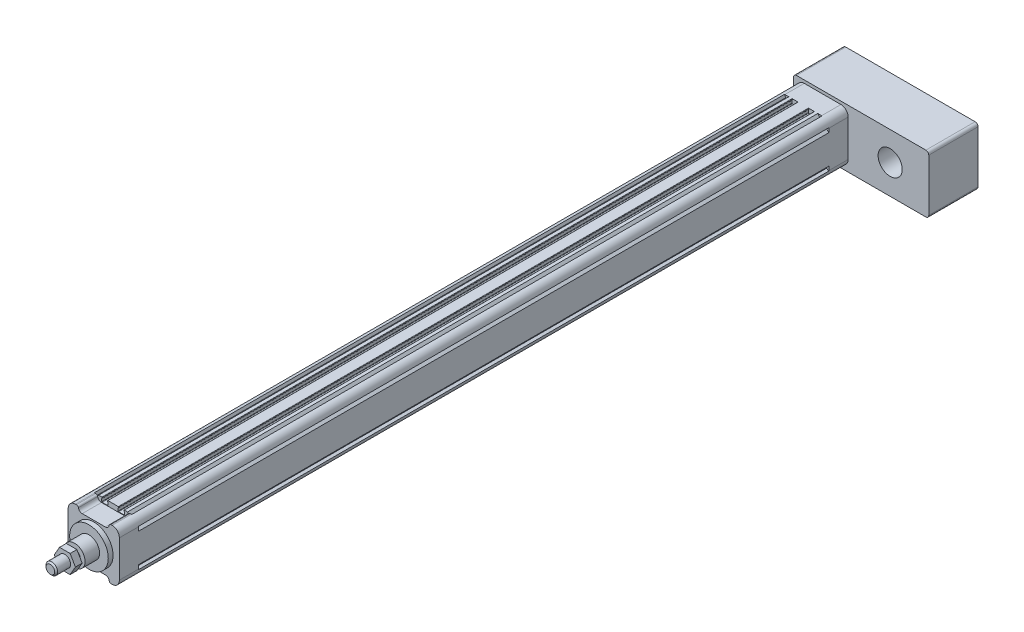
from build123d import *

# Parameters (mm, degrees)
SKETCH_1_R                  = 2.1
EXTRUDE_1_DEPTH             = 715
EXTRUDE_2_DEPTH             = 20
SKETCH_7_R                  = 20
EXTRUDE_3_DEPTH             = 5
SKETCH_9_R                  = 11
EXTRUDE_4_DEPTH             = 15
SKETCH_10_R                 = 6
EXTRUDE_5_DEPTH             = 25
EXTRUDE_START               = 20
EXTRUDE_6_DEPTH             = 20
EXTRUDE_7_DEPTH             = 51
SKETCH_13_R                 = 12.5
CUT_EXTRUDE_2_DEPTH         = 30
PATTERN_LINEAR_1_COUNT      = 2
PATTERN_LINEAR_1_PITCH      = 38
PATTERN_LINEAR_1_COUNT_DIR2 = 2
PATTERN_LINEAR_1_PITCH_DIR2 = 38
HOLE_WIZARD_M6_2_D          = 5
HOLE_WIZARD_M6_2_DEPTH      = 15
HOLE_WIZARD_M6_2_TIP        = 1.502151548
HOLE_WIZARD_M6_3_D          = 5
HOLE_WIZARD_M6_3_DEPTH      = 15
HOLE_WIZARD_M6_3_TIP        = 1.502151548
HOLE_WIZARD_M6_4_D          = 5
HOLE_WIZARD_M6_4_DEPTH      = 15
HOLE_WIZARD_M6_4_TIP        = 1.502151548
CHAMFER_1_SIZE              = 1.5
EXTRUDE_START_2             = 3
EXTRUDE_8_DEPTH             = 7


with BuildPart() as part:
    # 草图1 → 凸台-拉伸1 (new body)
    with BuildSketch(Plane.XY):
        with BuildLine():
            Line((-18.2, 24), (-19.443439638, 26.486879276))
            ThreePointArc((-19.443439638, 26.486879276), (-24.303300859, 24.303300859), (-26.486879276, 19.443439638))
            Line((-26.486879276, 19.443439638), (-24, 18.2))
            Line((-24, 18.2), (-24, 17.1))
            Line((-24, 17.1), (-26.5, 15))
            Line((-26.5, 15), (-26.5, -15))
            Line((-26.5, -15), (-24, -17.1))
            Line((-24, -17.1), (-24, -18.2))
            Line((-24, -18.2), (-26.486879276, -19.443439638))
            ThreePointArc((-26.486879276, -19.443439638), (-24.303300859, -24.303300859), (-19.443439638, -26.486879276))
            Line((-19.443439638, -26.486879276), (-18.2, -24))
            Line((-18.2, -24), (-17.1, -24))
            Line((-17.1, -24), (-15, -26.5))
            Line((-15, -26.5), (-11.65, -26.5))
            ThreePointArc((-11.65, -26.5), (-11.367157288, -26.382842712), (-11.25, -26.1))
            Line((-11.25, -26.1), (-11.25, -25.6))
            ThreePointArc((-11.25, -25.6), (-11.367157288, -25.317157288), (-11.65, -25.2))
            Line((-11.65, -25.2), (-11.75, -25.2))
            Line((-11.75, -25.2), (-11.75, -22.4))
            ThreePointArc((-11.75, -22.4), (-11.632842712, -22.117157288), (-11.35, -22))
            Line((-11.35, -22), (-5.65, -22))
            ThreePointArc((-5.65, -22), (-5.367157288, -22.117157288), (-5.25, -22.4))
            Line((-5.25, -22.4), (-5.25, -25.2))
            Line((-5.25, -25.2), (-5.35, -25.2))
            ThreePointArc((-5.35, -25.2), (-5.632842712, -25.317157288), (-5.75, -25.6))
            Line((-5.75, -25.6), (-5.75, -26.1))
            ThreePointArc((-5.75, -26.1), (-5.632842712, -26.382842712), (-5.35, -26.5))
            Line((-5.35, -26.5), (5.35, -26.5))
            ThreePointArc((5.35, -26.5), (5.632842712, -26.382842712), (5.75, -26.1))
            Line((5.75, -26.1), (5.75, -25.6))
            ThreePointArc((5.75, -25.6), (5.632842712, -25.317157288), (5.35, -25.2))
            Line((5.35, -25.2), (5.25, -25.2))
            Line((5.25, -25.2), (5.25, -22.4))
            ThreePointArc((5.25, -22.4), (5.367157288, -22.117157288), (5.65, -22))
            Line((5.65, -22), (11.35, -22))
            ThreePointArc((11.35, -22), (11.632842712, -22.117157288), (11.75, -22.4))
            Line((11.75, -22.4), (11.75, -25.2))
            Line((11.75, -25.2), (11.65, -25.2))
            ThreePointArc((11.65, -25.2), (11.367157288, -25.317157288), (11.25, -25.6))
            Line((11.25, -25.6), (11.25, -26.1))
            ThreePointArc((11.25, -26.1), (11.367157288, -26.382842712), (11.65, -26.5))
            Line((11.65, -26.5), (15, -26.5))
            Line((15, -26.5), (17.1, -24))
            Line((17.1, -24), (18.2, -24))
            Line((18.2, -24), (19.443439638, -26.486879276))
            ThreePointArc((19.443439638, -26.486879276), (24.303300859, -24.303300859), (26.486879276, -19.443439638))
            Line((26.486879276, -19.443439638), (24, -18.2))
            Line((24, -18.2), (24, -17.1))
            Line((24, -17.1), (26.5, -15))
            Line((26.5, -15), (26.5, 15))
            Line((26.5, 15), (24, 17.1))
            Line((24, 17.1), (24, 18.2))
            Line((24, 18.2), (26.486879276, 19.443439638))
            ThreePointArc((26.486879276, 19.443439638), (24.303300859, 24.303300859), (19.443439638, 26.486879276))
            Line((19.443439638, 26.486879276), (18.2, 24))
            Line((18.2, 24), (17.1, 24))
            Line((17.1, 24), (15, 26.5))
            Line((15, 26.5), (11.65, 26.5))
            ThreePointArc((11.65, 26.5), (11.367157288, 26.382842712), (11.25, 26.1))
            Line((11.25, 26.1), (11.25, 25.6))
            ThreePointArc((11.25, 25.6), (11.367157288, 25.317157288), (11.65, 25.2))
            Line((11.65, 25.2), (11.75, 25.2))
            Line((11.75, 25.2), (11.75, 22.4))
            ThreePointArc((11.75, 22.4), (11.632842712, 22.117157288), (11.35, 22))
            Line((11.35, 22), (5.65, 22))
            ThreePointArc((5.65, 22), (5.367157288, 22.117157288), (5.25, 22.4))
            Line((5.25, 22.4), (5.25, 25.2))
            Line((5.25, 25.2), (5.35, 25.2))
            ThreePointArc((5.35, 25.2), (5.632842712, 25.317157288), (5.75, 25.6))
            Line((5.75, 25.6), (5.75, 26.1))
            ThreePointArc((5.75, 26.1), (5.632842712, 26.382842712), (5.35, 26.5))
            Line((5.35, 26.5), (-5.35, 26.5))
            ThreePointArc((-5.35, 26.5), (-5.632842712, 26.382842712), (-5.75, 26.1))
            Line((-5.75, 26.1), (-5.75, 25.6))
            ThreePointArc((-5.75, 25.6), (-5.632842712, 25.317157288), (-5.35, 25.2))
            Line((-5.35, 25.2), (-5.25, 25.2))
            Line((-5.25, 25.2), (-5.25, 22.4))
            ThreePointArc((-5.25, 22.4), (-5.367157288, 22.117157288), (-5.65, 22))
            Line((-5.65, 22), (-11.35, 22))
            ThreePointArc((-11.35, 22), (-11.632842712, 22.117157288), (-11.75, 22.4))
            Line((-11.75, 22.4), (-11.75, 25.2))
            Line((-11.75, 25.2), (-11.65, 25.2))
            ThreePointArc((-11.65, 25.2), (-11.367157288, 25.317157288), (-11.25, 25.6))
            Line((-11.25, 25.6), (-11.25, 26.1))
            ThreePointArc((-11.25, 26.1), (-11.367157288, 26.382842712), (-11.65, 26.5))
            Line((-11.65, 26.5), (-15, 26.5))
            Line((-15, 26.5), (-17.1, 24))
            Line((-17.1, 24), (-18.2, 24))
        make_face()
        with Locations((19, 19)):
            Circle(SKETCH_1_R, mode=Mode.SUBTRACT)
        with Locations((19, -19)):
            Circle(SKETCH_1_R, mode=Mode.SUBTRACT)
        with Locations((-19, -19)):
            Circle(SKETCH_1_R, mode=Mode.SUBTRACT)
        with Locations((-19, 19)):
            Circle(SKETCH_1_R, mode=Mode.SUBTRACT)
        with BuildLine():
            Line((19.773719933, 3), (23.3, 3))
            Line((23.3, 3), (23.3, -3))
            Line((23.3, -3), (19.773719933, -3))
            ThreePointArc((19.773719933, -3), (0, -20), (-19.773719933, -3))
            Line((-19.773719933, -3), (-23.3, -3))
            Line((-23.3, -3), (-23.3, 3))
            Line((-23.3, 3), (-19.773719933, 3))
            ThreePointArc((-19.773719933, 3), (0, 20), (19.773719933, 3))
        make_face(mode=Mode.SUBTRACT)
    extrude(amount=EXTRUDE_1_DEPTH)

    # 草图6 → 凸台-拉伸2 (add)
    with BuildSketch(Plane.XY.offset(715)):
        with BuildLine():
            Line((-26.5, -19), (-26.5, 19))
            ThreePointArc((-26.5, 19), (-24.303300859, 24.303300859), (-19, 26.5))
            Line((-19, 26.5), (-17.916079783, 26.5))
            ThreePointArc((-17.916079783, 26.5), (-16.625085334, 26.027525232), (-15.944053189, 24.833333333))
            ThreePointArc((-15.944053189, 24.833333333), (-14.581988897, 22.444949537), (-12, 21.5))
            Line((-12, 21.5), (12, 21.5))
            ThreePointArc((12, 21.5), (14.581988897, 22.444949537), (15.944053189, 24.833333333))
            ThreePointArc((15.944053189, 24.833333333), (16.625085334, 26.027525232), (17.916079783, 26.5))
            Line((17.916079783, 26.5), (19, 26.5))
            ThreePointArc((19, 26.5), (24.303300859, 24.303300859), (26.5, 19))
            Line((26.5, 19), (26.5, -19))
            ThreePointArc((26.5, -19), (24.303300859, -24.303300859), (19, -26.5))
            Line((19, -26.5), (17.916079783, -26.5))
            ThreePointArc((17.916079783, -26.5), (16.625085334, -26.027525232), (15.944053189, -24.833333333))
            ThreePointArc((15.944053189, -24.833333333), (14.581988897, -22.444949537), (12, -21.5))
            Line((12, -21.5), (-12, -21.5))
            ThreePointArc((-12, -21.5), (-14.581988897, -22.444949537), (-15.944053189, -24.833333333))
            ThreePointArc((-15.944053189, -24.833333333), (-16.625085334, -26.027525232), (-17.916079783, -26.5))
            Line((-17.916079783, -26.5), (-19, -26.5))
            ThreePointArc((-19, -26.5), (-24.303300859, -24.303300859), (-26.5, -19))
        make_face()
    extrude(amount=EXTRUDE_2_DEPTH)

    # 草图7 → 凸台-拉伸3 (add)
    with BuildSketch(Plane.XY.offset(735)):
        Circle(SKETCH_7_R)
    extrude(amount=EXTRUDE_3_DEPTH)

    # 草图9 → 凸台-拉伸4 (add)
    with BuildSketch(Plane.XY.offset(740)):
        Circle(SKETCH_9_R)
    extrude(amount=EXTRUDE_4_DEPTH)

    # 草图10 → 凸台-拉伸5 (add)
    with BuildSketch(Plane.XY.offset(755)):
        Circle(SKETCH_10_R)
    extrude(amount=EXTRUDE_5_DEPTH)

    # 草图11 → 凸台-拉伸6 (add)
    with BuildSketch(Plane(origin=(0, 0, 0), x_dir=(-1, 0, 0), z_dir=(0, 0, -1)).offset(EXTRUDE_START)):
        with BuildLine():
            Line((-19, -26.5), (19, -26.5))
            ThreePointArc((19, -26.5), (24.303300859, -24.303300859), (26.5, -19))
            Line((26.5, -19), (26.5, 19))
            ThreePointArc((26.5, 19), (24.303300859, 24.303300859), (19, 26.5))
            Line((19, 26.5), (-19, 26.5))
            ThreePointArc((-19, 26.5), (-24.303300859, 24.303300859), (-26.5, 19))
            Line((-26.5, 19), (-26.5, -19))
            ThreePointArc((-26.5, -19), (-24.303300859, -24.303300859), (-19, -26.5))
        make_face()
    extrude(amount=-EXTRUDE_6_DEPTH)

    # 草图12 → 凸台-拉伸7 (add)
    with BuildSketch(Plane(origin=(0, 0, -20), x_dir=(-1, 0, 0), z_dir=(0, 0, -1))):
        with BuildLine():
            Line((-107, -30.404162038), (27, -30.404162038))
            ThreePointArc((27, -30.404162038), (29.121320344, -29.525482382), (30, -27.404162038))
            Line((30, -27.404162038), (30, 26.595837962))
            ThreePointArc((30, 26.595837962), (29.121320344, 28.717158305), (27, 29.595837962))
            Line((27, 29.595837962), (-107, 29.595837962))
            ThreePointArc((-107, 29.595837962), (-109.121320344, 28.717158305), (-110, 26.595837962))
            Line((-110, 26.595837962), (-110, -27.404162038))
            ThreePointArc((-110, -27.404162038), (-109.121320344, -29.525482382), (-107, -30.404162038))
        make_face()
    extrude(amount=EXTRUDE_7_DEPTH)

    # 草图13 → 切除-拉伸2 (cut)
    with BuildSketch(Plane.XY.offset(-20)):
        with Locations((70, 0)):
            Circle(SKETCH_13_R)
    extrude(amount=-CUT_EXTRUDE_2_DEPTH, mode=Mode.SUBTRACT)

    # 草图15 → M6 螺纹孔1 (revolve, cut)
    with BuildSketch(Plane(origin=(-19, -19, -71), x_dir=(0, 1, 0), z_dir=(1, 0, 0))):
        Polygon((0, 0), (0, 16.502151548), (2.5, 15), (2.5, 0), align=None)
    hole_wizard_m6_1 = revolve(axis=Axis((-19, -19, -77.35), (0, 0, 1)), mode=Mode.SUBTRACT)

    # 阵列(线性)1: Hole Wizard M6 _1 2 × 2
    with Locations(*[(j * PATTERN_LINEAR_1_PITCH_DIR2, i * PATTERN_LINEAR_1_PITCH, 0) for i in range(PATTERN_LINEAR_1_COUNT) for j in range(PATTERN_LINEAR_1_COUNT_DIR2) if (i, j) != (0, 0)]):
        add(hole_wizard_m6_1, mode=Mode.SUBTRACT)

    # M6 螺纹孔2
    with Locations(Plane(origin=(0, 0, -71), x_dir=(-1, 0, 0), z_dir=(0, 0, -1))):
        with Locations((-84, -19), (-84, 19)):
            Hole(HOLE_WIZARD_M6_2_D / 2, depth=HOLE_WIZARD_M6_2_DEPTH)
            with Locations((0, 0, -(HOLE_WIZARD_M6_2_DEPTH + HOLE_WIZARD_M6_2_TIP / 2))):  # 118° drill point
                Cone(0, HOLE_WIZARD_M6_2_D / 2, HOLE_WIZARD_M6_2_TIP, mode=Mode.SUBTRACT)

    # M6 螺纹孔3
    with Locations(Plane.ZY.offset(26.5)):
        with Locations((725, 11), (725, -11)):
            Hole(HOLE_WIZARD_M6_3_D / 2, depth=HOLE_WIZARD_M6_3_DEPTH)
            with Locations((0, 0, -(HOLE_WIZARD_M6_3_DEPTH + HOLE_WIZARD_M6_3_TIP / 2))):  # 118° drill point
                Cone(0, HOLE_WIZARD_M6_3_D / 2, HOLE_WIZARD_M6_3_TIP, mode=Mode.SUBTRACT)

    # M6 螺纹孔4
    with Locations(Plane.ZY.offset(26.5)):
        with Locations((-10, 11), (-10, -11)):
            Hole(HOLE_WIZARD_M6_4_D / 2, depth=HOLE_WIZARD_M6_4_DEPTH)
            with Locations((0, 0, -(HOLE_WIZARD_M6_4_DEPTH + HOLE_WIZARD_M6_4_TIP / 2))):  # 118° drill point
                Cone(0, HOLE_WIZARD_M6_4_D / 2, HOLE_WIZARD_M6_4_TIP, mode=Mode.SUBTRACT)

    # 倒角1
    chamfer_1_edges = [part.edges().sort_by_distance(p)[0] for p in [
        (-6, 0, 780),
    ]]
    chamfer(chamfer_1_edges, length=CHAMFER_1_SIZE)

    # 草图23 → 凸台-拉伸8 (add)
    with BuildSketch(Plane.XY.offset(755).offset(EXTRUDE_START_2)):
        Polygon((10.969655115, 0), (5.484827557, 9.5), (-5.484827557, 9.5), (-10.969655115, 0), (-5.484827557, -9.5), (5.484827557, -9.5), align=None)
    extrude(amount=EXTRUDE_8_DEPTH)


solid = part.part
